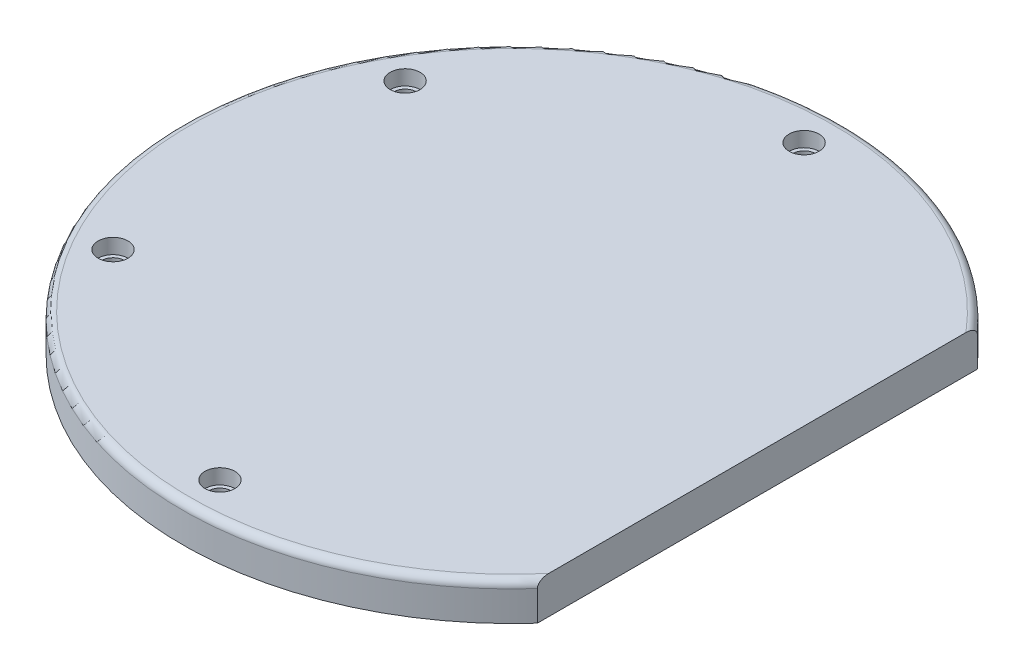
from build123d import *

# Parameters (mm, degrees)
PATTERN_CIRCULAR_1_COUNT = 4
PATTERN_CIRCULAR_1_ANGLE = 180
CUT_EXTRUDE_1_DEPTH      = 63.425956281


with BuildPart() as part:
    # Эскиз1 → Повернуть1 (revolve)
    with BuildSketch(Plane(origin=(0, 0, 0), x_dir=(0, 0, -1), z_dir=(1, 0, 0))):
        with BuildLine():
            Line((0, 0), (44, 0))
            Line((44, 0), (44, 4))
            ThreePointArc((44, 4), (43.707106781, 4.707106781), (43, 5))
            Line((43, 5), (0, 5))
            Line((0, 5), (0, 0))
        make_face()
    revolve(axis=Axis((0, 0, 0), (0, 1, 0)))

    # Эскиз2 → Вырез-Повернуть1 (revolve, cut)
    with BuildSketch(Plane(origin=(0, 0, 0), x_dir=(0, 0, -1), z_dir=(1, 0, 0))):
        Polygon((-39, 0), (-37.5, 0), (-37.5, 3), (-37, 3), (-37, 5), (-39, 5), align=None)
    cut_revolve_1 = revolve(axis=Axis((0, 0, 39), (0, 1, 0)), mode=Mode.SUBTRACT)

    # Круговой массив1: Вырез-Повернуть1 ×4 about axis
    pattern_circular_1_axis = Axis((0, 0, 0), (0, -1, 0))
    for i in range(1, PATTERN_CIRCULAR_1_COUNT):
        add(cut_revolve_1.rotate(pattern_circular_1_axis, i * PATTERN_CIRCULAR_1_ANGLE / (PATTERN_CIRCULAR_1_COUNT - 1)), mode=Mode.SUBTRACT)

    # Эскиз3 → Вырез-Вытянуть1 (cut, through all)
    with BuildSketch(Plane.XZ):
        with BuildLine():
            Line((32.759496508, 29.373719352), (32.759496508, -29.373719352))
            ThreePointArc((32.759496508, -29.373719352), (44, 0), (32.759496508, 29.373719352))
        make_face()
    extrude(amount=-CUT_EXTRUDE_1_DEPTH, mode=Mode.SUBTRACT)


solid = part.part
